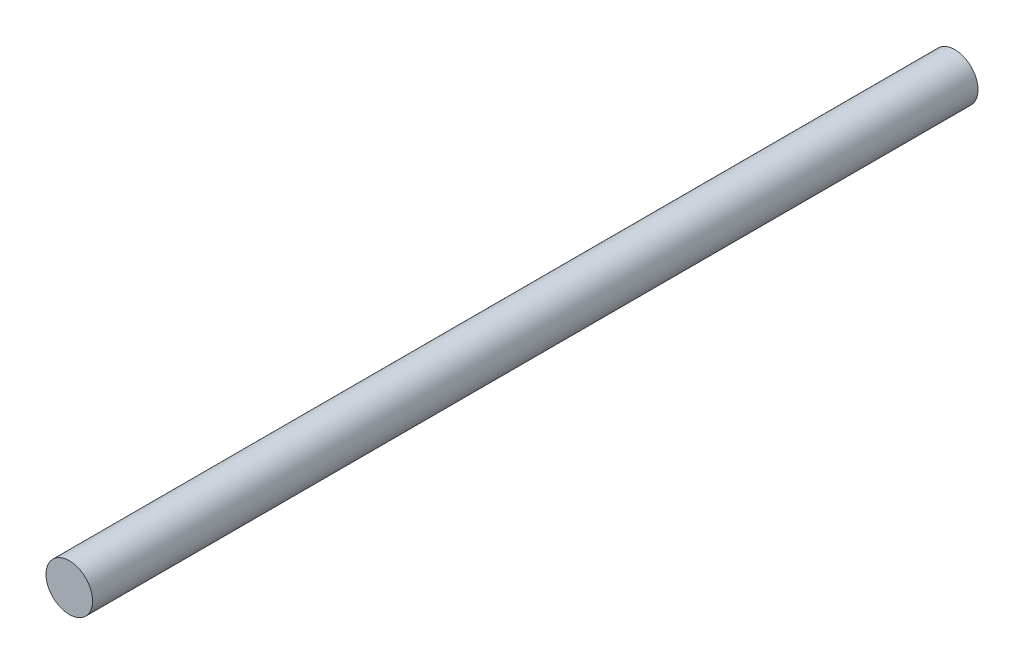
from build123d import *

# Parameters (mm, degrees)
SKETCH1_R           = 3.175
BOSS_EXTRUDE1_DEPTH = 120.65


with BuildPart() as part:
    # Sketch1 → Boss-Extrude1 (new body)
    with BuildSketch(Plane.XY):
        with Locations(Location((0, 0, 0), (0, 0, 180))):
            Circle(SKETCH1_R)
    extrude(amount=BOSS_EXTRUDE1_DEPTH)


solid = part.part
